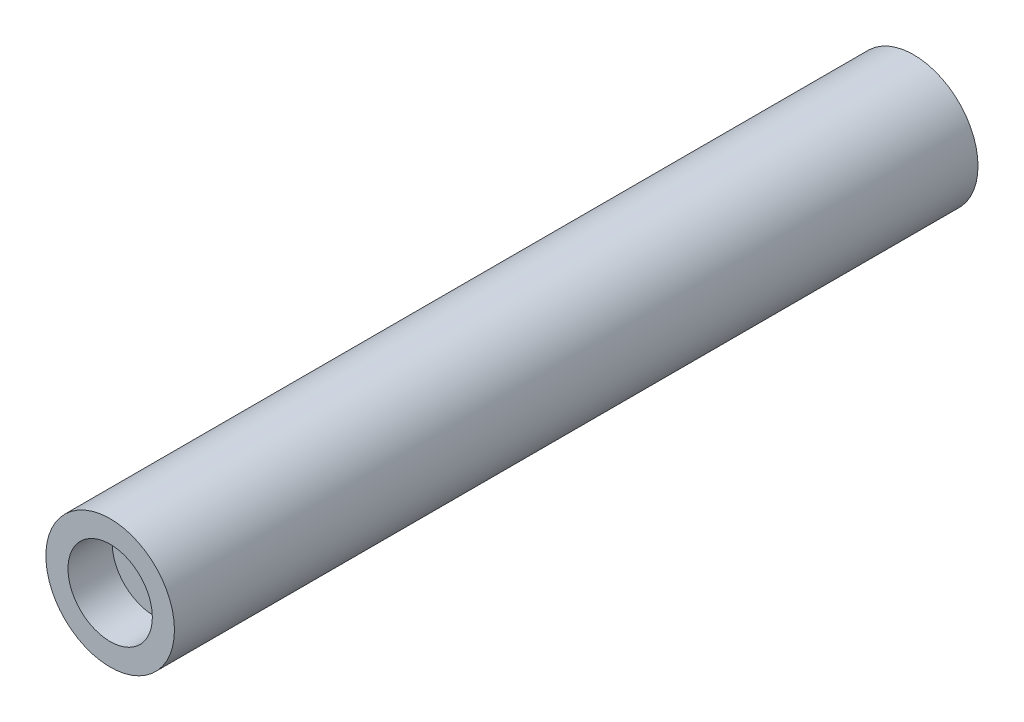
from build123d import *

# Parameters (mm, degrees)
SKETCH2_R           = 8
BOSS_EXTRUDE1_DEPTH = 100
SKETCH3_R           = 5.25
CUT_EXTRUDE1_DEPTH  = 21
CUT_EXTRUDE2_START  = -5.5
SKETCH4_R           = 5.25
CUT_EXTRUDE2_DEPTH  = 5.5


with BuildPart() as part:
    # Sketch2 → Boss-Extrude1 (new body)
    with BuildSketch(Plane.XY):
        Circle(SKETCH2_R)
    extrude(amount=BOSS_EXTRUDE1_DEPTH)

    # Sketch3 → Cut-Extrude1 (cut)
    with BuildSketch(Plane(origin=(0, 0, 0), x_dir=(-1, 0, 0), z_dir=(0, 0, -1))):
        Circle(SKETCH3_R)
    extrude(amount=-CUT_EXTRUDE1_DEPTH, mode=Mode.SUBTRACT)

    # Sketch4 → Cut-Extrude2 (cut)
    with BuildSketch(Plane.XY.offset(100).offset(CUT_EXTRUDE2_START)):
        Circle(SKETCH4_R)
    extrude(amount=CUT_EXTRUDE2_DEPTH, mode=Mode.SUBTRACT)


solid = part.part
